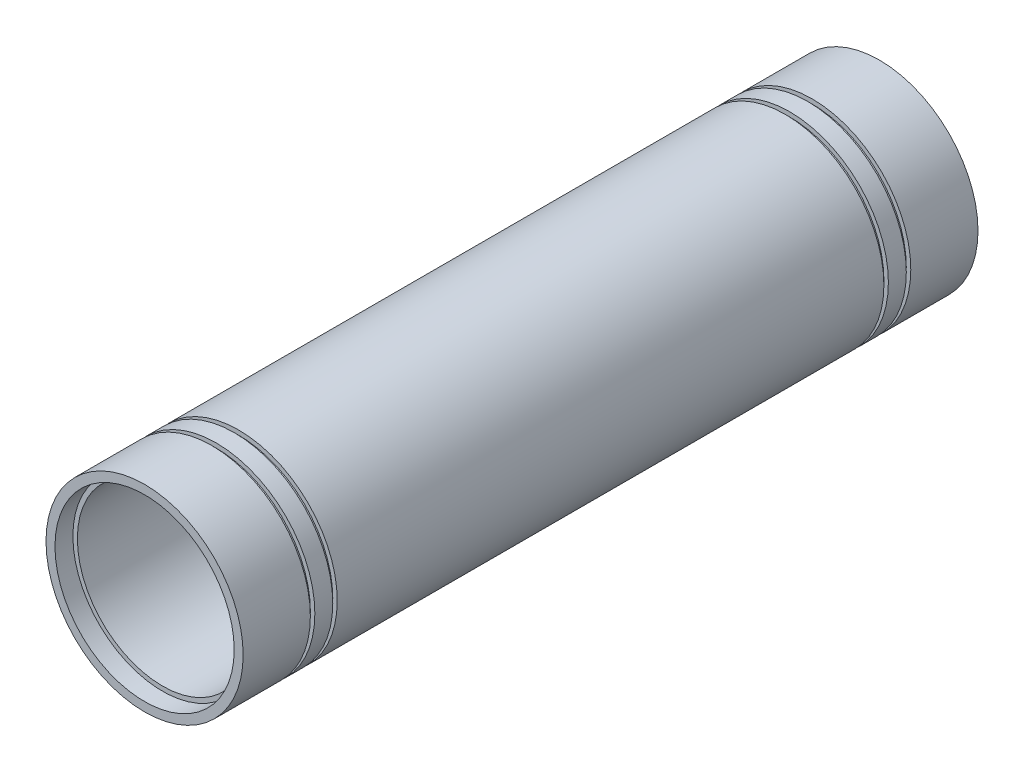
from build123d import *

# Parameters (mm, degrees)
SKETCH_1_R          = 11
SKETCH_1_R_2        = 9.5
EXTRUDE_1_DEPTH     = 82
SKETCH_4_R          = 10
CUT_EXTRUDE_2_DEPTH = 2
CUT_EXTRUDE_START   = -2
SKETCH_5_R          = 10
CUT_EXTRUDE_3_DEPTH = 2
SKETCH_6_R          = 11.5
SKETCH_6_R_2        = 10.5
CUT_EXTRUDE_4_DEPTH = 0.5
SKETCH_7_R          = 11.5
SKETCH_7_R_2        = 10.5
CUT_EXTRUDE_5_DEPTH = 0.5


with BuildPart() as part:
    # Эскиз1 → Бобышка-Вытянуть1 (new body)
    with BuildSketch(Plane.XY):
        Circle(SKETCH_1_R)
        Circle(SKETCH_1_R_2, mode=Mode.SUBTRACT)
    extrude(amount=EXTRUDE_1_DEPTH)

    # Эскиз4 → Вырез-Вытянуть2 (cut)
    with BuildSketch(Plane(origin=(0, 0, 0), x_dir=(-1, 0, 0), z_dir=(0, 0, -1))):
        Circle(SKETCH_4_R)
    extrude(amount=-CUT_EXTRUDE_2_DEPTH, mode=Mode.SUBTRACT)

    # Эскиз5 → Вырез-Вытянуть3 (cut)
    with BuildSketch(Plane.XY.offset(82).offset(CUT_EXTRUDE_START)):
        with Locations(Location((0, 0, 0), (0, 0, 180))):
            Circle(SKETCH_5_R)
    extrude(amount=CUT_EXTRUDE_3_DEPTH, mode=Mode.SUBTRACT)

    # Эскиз6 → Вырез-Вытянуть4 (cut)
    with BuildSketch(Plane.XY.offset(74.5)):
        Circle(SKETCH_6_R)
        Circle(SKETCH_6_R_2, mode=Mode.SUBTRACT)
    cut_extrude_4 = extrude(amount=-CUT_EXTRUDE_4_DEPTH, mode=Mode.SUBTRACT)

    # Эскиз7 → Вырез-Вытянуть5 (cut)
    with BuildSketch(Plane.XY.offset(72)):
        Circle(SKETCH_7_R)
        Circle(SKETCH_7_R_2, mode=Mode.SUBTRACT)
    cut_extrude_5 = extrude(amount=-CUT_EXTRUDE_5_DEPTH, mode=Mode.SUBTRACT)

    # Зеркальное отражение1: Вырез-Вытянуть4, Вырез-Вытянуть5 across plane
    add(cut_extrude_4.mirror(Plane.XY.offset(41)), mode=Mode.SUBTRACT)
    add(cut_extrude_5.mirror(Plane.XY.offset(41)), mode=Mode.SUBTRACT)


solid = part.part
